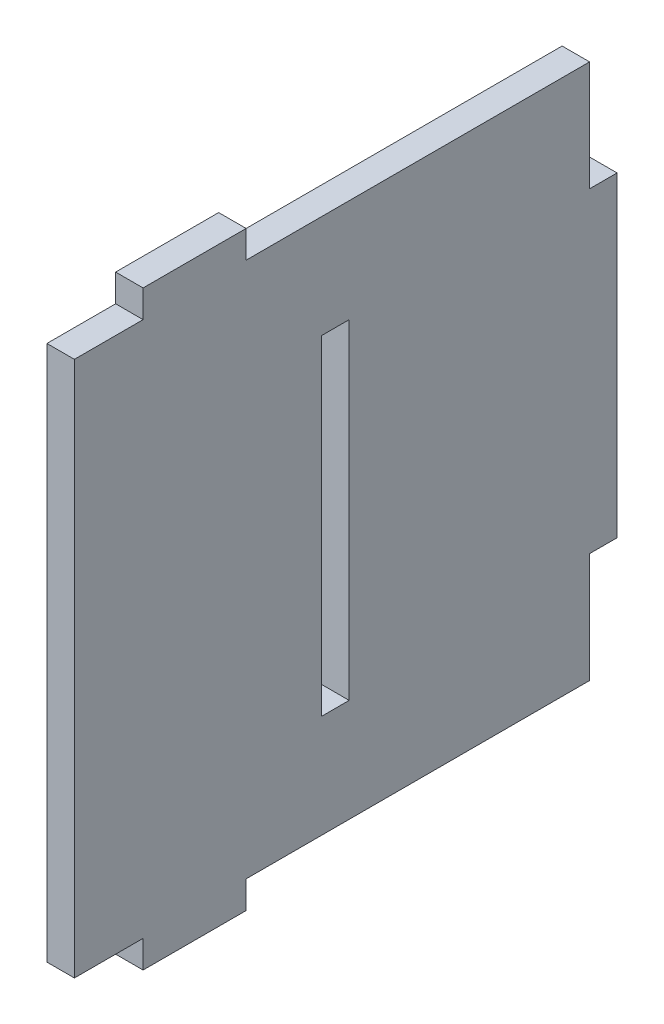
from build123d import *

# Parameters (mm, degrees)
SKETCH1_W           = 4
SKETCH1_H           = 48
BOSS_EXTRUDE1_DEPTH = 4


with BuildPart() as part:
    # Sketch1 → Boss-Extrude1 (new body)
    with BuildSketch(Plane(origin=(0, 0, 0), x_dir=(0, 0, -1), z_dir=(1, 0, 0))):
        Polygon((10, 0), (10, -4), (25, -4), (25, 0), (75, 0), (75, 16), (79, 16), (79, 62), (75, 62), (75, 78), (25, 78), (25, 82), (10, 82), (10, 78), (0, 78), (0, 0), align=None)
        with Locations((38, 39)):
            Rectangle(SKETCH1_W, SKETCH1_H, mode=Mode.SUBTRACT)
    extrude(amount=BOSS_EXTRUDE1_DEPTH)


solid = part.part
